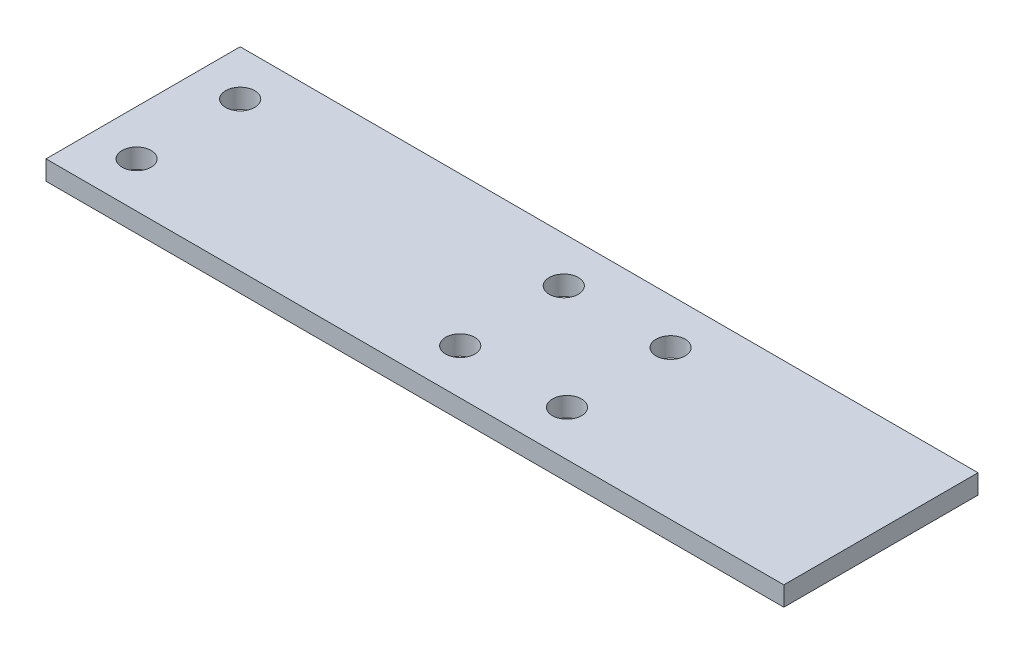
from build123d import *

# Parameters (mm, degrees)
SKETCH1_R           = 2.25
BOSS_EXTRUDE1_DEPTH = 3


with BuildPart() as part:
    # Sketch1 → Boss-Extrude1 (new body)
    with BuildSketch(Plane(origin=(0, 0, 0), x_dir=(1, 0, 0), z_dir=(0, 1, 0))):
        Polygon((-7, 23), (-7, -7), (57, -7), (107, -7), (107, 23), (57, 23), align=None)
        with Locations(Location((0, 0, 0), (0, 0, 270))):
            Circle(SKETCH1_R, mode=Mode.SUBTRACT)
        with Locations(Location((0, 16, 0), (0, 0, 270))):
            Circle(SKETCH1_R, mode=Mode.SUBTRACT)
        with Locations(Location((50, 0, 0), (0, 0, 270))):
            Circle(SKETCH1_R, mode=Mode.SUBTRACT)
        with Locations(Location((50, 16, 0), (0, 0, 270))):
            Circle(SKETCH1_R, mode=Mode.SUBTRACT)
        with Locations(Location((66.5, 16, 0), (0, 0, 270))):
            Circle(SKETCH1_R, mode=Mode.SUBTRACT)
        with Locations(Location((66.5, 0, 0), (0, 0, 270))):
            Circle(SKETCH1_R, mode=Mode.SUBTRACT)
    extrude(amount=BOSS_EXTRUDE1_DEPTH)


solid = part.part
